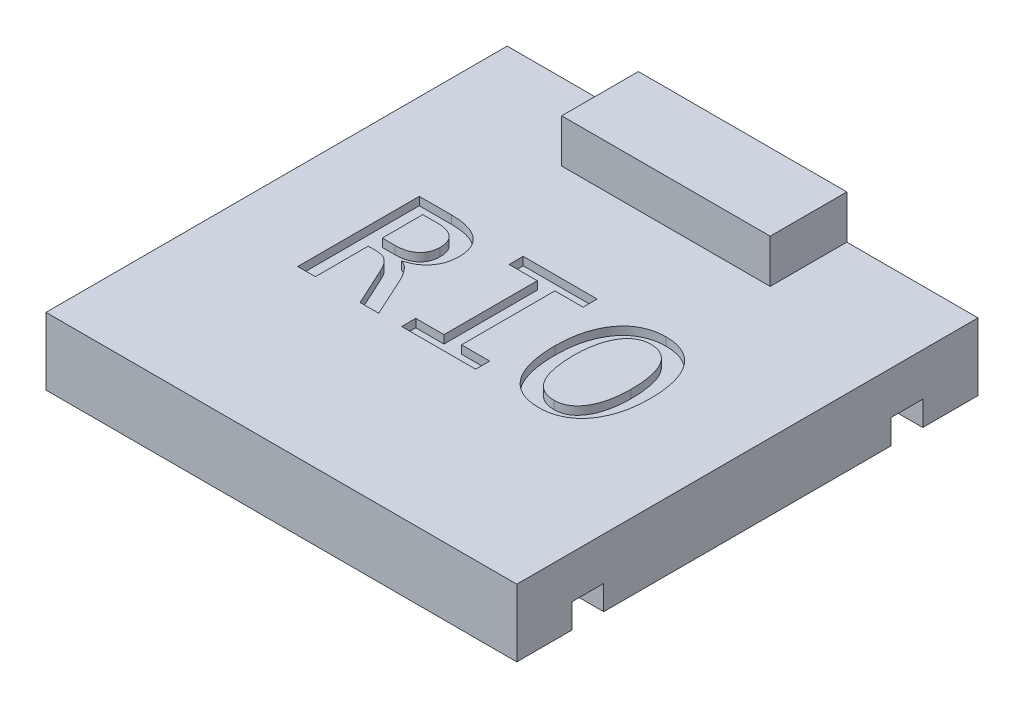
from build123d import *

# Parameters (mm, degrees)
SKETCH1_W           = 146.1516
SKETCH1_H           = 143.1798
BOSS_EXTRUDE1_DEPTH = 17.2085
SKETCH3_W           = 40.7162
SKETCH3_H           = 23.7998
CUT_EXTRUDE2_DEPTH  = 13.5128
CUT_EXTRUDE1_DEPTH  = 2.54
SKETCH4_W           = 9.8298
SKETCH4_H           = 7.62
CUT_EXTRUDE3_DEPTH  = 10.16


with BuildPart() as part:
    # Sketch1 → Boss-Extrude1 (new, symmetric)
    with BuildSketch(Plane(origin=(0, 0, 0), x_dir=(1, 0, 0), z_dir=(0, 1, 0))):
        with Locations((73.0758, 71.5899)):
            Rectangle(SKETCH1_W, SKETCH1_H)
    extrude(amount=BOSS_EXTRUDE1_DEPTH, both=True)

    # Sketch3 → Cut-Extrude2 (cut)
    with BuildSketch(Plane(origin=(0, 17.2085, 0), x_dir=(1, 0, 0), z_dir=(0, 1, 0))):
        Polygon((0, 119.38), (0, 0), (146.1516, 0), (146.1516, 119.38), (105.4354, 119.38), (40.7162, 119.38), align=None)
        with Locations((20.3581, 131.2799)):
            Rectangle(SKETCH3_W, SKETCH3_H)
        with Locations((125.7935, 131.2799)):
            Rectangle(SKETCH3_W, SKETCH3_H)
    extrude(amount=-CUT_EXTRUDE2_DEPTH, mode=Mode.SUBTRACT)

    # Sketch2 → Cut-Extrude1 (cut)
    # profile 1 of 3: a face of its own
    with BuildSketch(Plane(origin=(0, 3.6957, 0), x_dir=(1, 0, 0), z_dir=(0, 1, 0))):
        with BuildLine():
            Line((51.897428627, 51.406813945), (46.104961162, 51.406813945))
            Line((46.104961162, 51.406813945), (40.679862577, 63.18824851))
            add(Edge.make_bspline(
                [(40.679862577, 63.18824851), (40.483830981, 63.605943537), (40.120168029, 64.38081968), (39.47986165, 65.398297488), (38.816682071, 66.21807576), (38.098308017, 66.84831408), (37.314584981, 67.308101815), (36.460547923, 67.605576377), (35.523807529, 67.778497566), (34.871097282, 67.799329504), (34.528569693, 67.810261635)],
                knots=[0, 0, 0, 0, 1.339134837, 2.484261414, 3.482991323, 4.391871607, 5.244507385, 6.105289549, 7.005698766, 8, 8, 8, 8], degree=3))
            Line((34.528569693, 67.810261635), (32.213291399, 67.810261635))
            Line((32.213291399, 67.810261635), (32.213291399, 51.406813945))
            Line((32.213291399, 51.406813945), (26.745475502, 51.406813945))
            Line((26.745475502, 51.406813945), (26.745475502, 89.134743632))
            Line((26.745475502, 89.134743632), (36.775500288, 89.134743632))
            add(Edge.make_bspline(
                [(36.775500288, 89.134743632), (37.302681799, 89.127913375), (38.31909976, 89.114744483), (39.786710459, 88.975921697), (41.139560182, 88.751972397), (42.375563132, 88.424329853), (43.503095451, 88.02397482), (44.526021136, 87.545542542), (45.444479791, 86.991805966), (46.254962537, 86.359987855), (46.971456258, 85.670484395), (47.57273165, 84.8981556), (48.082603476, 84.066279794), (48.482753218, 83.162172962), (48.786159546, 82.203686429), (49.012635335, 81.195363881), (49.139075054, 80.136040526), (49.155282954, 79.412603941), (49.163520679, 79.04491461)],
                knots=[0, 0, 0, 0, 1.390037284, 2.680023546, 3.883960013, 5.002565466, 6.047913656, 7.03574216, 7.976084698, 8.870016629, 9.741095147, 10.591561451, 11.444313202, 12.308368875, 13.191986167, 14.092206828, 15.030357037, 16, 16, 16, 16], degree=3))
            add(Edge.make_bspline(
                [(49.163520679, 79.04491461), (49.156693074, 78.748461982), (49.143265746, 78.165451251), (49.044573258, 77.30344548), (48.895136067, 76.465132853), (48.671222735, 75.65439579), (48.388857463, 74.874394586), (48.047842444, 74.125746648), (47.634014419, 73.416717874), (47.165581143, 72.739922522), (46.632586803, 72.106290479), (46.043943587, 71.513686529), (45.385574727, 70.976024668), (44.682908643, 70.470843949), (43.916726351, 70.023860793), (43.094770543, 69.641940171), (42.221223932, 69.313395824), (41.612652624, 69.149433507), (41.303535327, 69.066150599)],
                knots=[0, 0, 0, 0, 1.032708305, 2.030948508, 3.019625047, 3.996933367, 4.957424013, 5.907556856, 6.85893238, 7.814077788, 8.77200233, 9.740252168, 10.719774328, 11.730219428, 12.753012585, 13.805036997, 14.885091985, 16, 16, 16, 16], degree=3))
            add(Edge.make_bspline(
                [(41.303535327, 69.066150599), (41.554783811, 68.973998212), (42.053277595, 68.791161717), (42.738667943, 68.384004824), (43.38330315, 67.910743187), (43.947051297, 67.305916333), (44.498247106, 66.624671051), (45.044616799, 65.839696199), (45.599446914, 64.953859033), (45.948837547, 64.315083406), (46.130591549, 63.982790507)],
                knots=[0, 0, 0, 0, 0.890820497, 1.767447404, 2.649001527, 3.549193506, 4.515009134, 5.571837998, 6.736863216, 8, 8, 8, 8], degree=3))
            Line((46.130591549, 63.982790507), (51.897428627, 51.406813945))
        make_face()
        with BuildLine():
            add(Edge.make_bspline(
                [(43.695704782, 78.67754573), (43.691704724, 78.925552618), (43.683954429, 79.406077281), (43.598171311, 80.101652653), (43.451381884, 80.747459472), (43.255845154, 81.345892856), (43.011542776, 81.902591014), (42.687539634, 82.398367146), (42.321829385, 82.854515238), (41.899399839, 83.259091267), (41.42366003, 83.611042159), (40.900950503, 83.916932289), (40.336117273, 84.183602998), (39.723632751, 84.398816343), (39.064286648, 84.556156025), (38.359916992, 84.678827137), (37.608289031, 84.74404489), (37.091717716, 84.75491532), (36.826761062, 84.760490915)],
                knots=[0, 0, 0, 0, 1.136086502, 2.201219443, 3.204852043, 4.166451082, 5.083443327, 5.98129036, 6.87199526, 7.758098985, 8.653381414, 9.577773354, 10.529401831, 11.511765708, 12.546811162, 13.632454437, 14.78565276, 16, 16, 16, 16], degree=3))
            Line((36.826761062, 84.760490915), (32.213291399, 84.760490915))
            Line((32.213291399, 84.760490915), (32.213291399, 72.184514352))
            Line((32.213291399, 72.184514352), (36.168914462, 72.184514352))
            add(Edge.make_bspline(
                [(36.168914462, 72.184514352), (36.450965369, 72.189555207), (37.001923444, 72.199402008), (37.805634186, 72.272432302), (38.562800046, 72.416510462), (39.280933641, 72.586895609), (39.949586964, 72.828546714), (40.565338003, 73.12090094), (41.138548706, 73.4519071), (41.648672003, 73.849336312), (42.116382709, 74.286355769), (42.525728096, 74.774241474), (42.881825913, 75.308594618), (43.169326073, 75.896703746), (43.414841644, 76.525411495), (43.569362791, 77.208083183), (43.678255403, 77.927920177), (43.689794629, 78.42364546), (43.695704782, 78.67754573)],
                knots=[0, 0, 0, 0, 1.202615583, 2.349188572, 3.435207305, 4.486530095, 5.492783739, 6.45958443, 7.390413995, 8.308405015, 9.210274755, 10.115082188, 11.017605575, 11.940721498, 12.901403136, 13.887978084, 14.918265918, 16, 16, 16, 16], degree=3))
        make_face(mode=Mode.SUBTRACT)
    # profile 2 of 3: a face of its own
    with BuildSketch(Plane(origin=(0, 3.6957, 0), x_dir=(1, 0, 0), z_dir=(0, 1, 0))):
        Polygon((67.754094728, 84.760490915), (59.005589293, 84.760490915), (59.005589293, 89.134743632), (81.970416059, 89.134743632), (81.970416059, 84.760490915), (73.221910624, 84.760490915), (73.221910624, 55.781066662), (81.970416059, 55.781066662), (81.970416059, 51.406813945), (59.005589293, 51.406813945), (59.005589293, 55.781066662), (67.754094728, 55.781066662), align=None)
    # profile 3 of 3: a face of its own
    with BuildSketch(Plane(origin=(0, 3.6957, 0), x_dir=(1, 0, 0), z_dir=(0, 1, 0))):
        with BuildLine():
            add(Edge.make_bspline(
                [(116.964437798, 70.518539196), (116.95025853, 69.697805464), (116.922878164, 68.112957116), (116.697342365, 65.823086408), (116.339701457, 63.703494472), (115.817903409, 61.757506526), (115.162917465, 59.985518067), (114.423719335, 58.364200322), (113.568522976, 56.906472106), (112.61055432, 55.606930425), (111.55190532, 54.476809263), (110.420395987, 53.483355321), (109.178551447, 52.676205036), (107.871097107, 52.004945837), (106.498270487, 51.495185782), (105.085141369, 51.124415017), (103.631897798, 50.908161329), (102.651984462, 50.876149616), (102.158617565, 50.860032355)],
                knots=[0, 0, 0, 0, 1.423082774, 2.747992794, 3.986236128, 5.147128242, 6.236197569, 7.259302453, 8.233395673, 9.161912359, 10.053001658, 10.914402565, 11.766421957, 12.614596425, 13.458547256, 14.300675266, 15.144423756, 16, 16, 16, 16], degree=3))
            add(Edge.make_bspline(
                [(102.158617565, 50.860032355), (101.576706465, 50.875915974), (100.447200161, 50.906746538), (98.810990056, 51.160044959), (97.289489083, 51.565694189), (95.881285306, 52.141398616), (94.597388719, 52.881953953), (93.418771664, 53.760101263), (92.364160933, 54.795648247), (91.421063063, 55.971668933), (90.59684061, 57.292527711), (89.891820329, 58.749940262), (89.292445103, 60.33994047), (88.809641006, 62.061516495), (88.436714907, 63.906693328), (88.178346112, 65.867885513), (88.010027209, 67.938313744), (87.993487937, 69.356283398), (87.985013546, 70.082822617)],
                knots=[0, 0, 0, 0, 1.030115455, 1.999483942, 2.924432069, 3.813267415, 4.685316872, 5.542716903, 6.40939724, 7.295524004, 8.206506083, 9.160640047, 10.158252241, 11.211975818, 12.323750963, 13.4892538, 14.713543989, 16, 16, 16, 16], degree=3))
            add(Edge.make_bspline(
                [(87.985013546, 70.082822617), (88.000346109, 70.89490602), (88.029991432, 72.465059342), (88.240870452, 74.739036365), (88.603610375, 76.845523266), (89.116278017, 78.785746154), (89.758439774, 80.558249929), (90.502910519, 82.17406507), (91.342437541, 83.636877188), (92.308288425, 84.926308413), (93.365466628, 86.059815832), (94.498175655, 87.050435292), (95.728904343, 87.867895193), (97.029276429, 88.538225372), (98.397548025, 89.044583508), (99.807006374, 89.418442715), (101.257808362, 89.633168481), (102.23768242, 89.665331687), (102.731029542, 89.681525222)],
                knots=[0, 0, 0, 0, 1.41309666, 2.732205102, 3.969807196, 5.128608405, 6.219709524, 7.24631839, 8.221244419, 9.148965463, 10.043106611, 10.914447659, 11.761129373, 12.607796584, 13.454637821, 14.294855332, 15.141493535, 16, 16, 16, 16], degree=3))
            add(Edge.make_bspline(
                [(102.731029542, 89.681525222), (103.312843273, 89.665152983), (104.444976745, 89.633294746), (106.083301756, 89.386064369), (107.603289725, 88.96552876), (109.006366789, 88.381666644), (110.296676629, 87.641794422), (111.472794416, 86.757427306), (112.537595278, 85.729558621), (113.474072791, 84.551490771), (114.308415099, 83.239409229), (115.03606185, 81.79637607), (115.628194006, 80.208298118), (116.124165432, 78.498006977), (116.502560181, 76.663401746), (116.774434597, 74.714408038), (116.938590059, 72.654404303), (116.955680298, 71.242193902), (116.964437798, 70.518539196)],
                knots=[0, 0, 0, 0, 1.031800753, 2.007749398, 2.930678117, 3.822900438, 4.696376593, 5.562252438, 6.426830471, 7.314406963, 8.225311853, 9.18096675, 10.175487812, 11.227471919, 12.337140194, 13.495232744, 14.716489688, 16, 16, 16, 16], degree=3))
        make_face()
        with BuildLine():
            add(Edge.make_bspline(
                [(111.496621902, 70.151170316), (111.488352876, 70.697998258), (111.472149395, 71.769529149), (111.395575832, 73.341507408), (111.224407992, 74.83934071), (111.01932047, 76.264004744), (110.741781426, 77.60738672), (110.380548022, 78.856655425), (109.960834425, 80.016965389), (109.445882406, 81.072355307), (108.856410479, 82.022793378), (108.197117686, 82.876471747), (107.44151885, 83.60097473), (106.61255105, 84.218993485), (105.699591609, 84.711598538), (104.694723748, 85.065039608), (103.599446099, 85.270490036), (102.840130278, 85.29476916), (102.449095285, 85.307272505)],
                knots=[0, 0, 0, 0, 1.323673599, 2.593790554, 3.807090586, 4.970987518, 6.076778004, 7.123914636, 8.116191169, 9.059475772, 9.960330598, 10.819370074, 11.662669578, 12.485668992, 13.315223066, 14.163241623, 15.054100047, 16, 16, 16, 16], degree=3))
            add(Edge.make_bspline(
                [(102.449095285, 85.307272505), (102.069474883, 85.291472211), (101.329624884, 85.260678693), (100.256199257, 85.050703617), (99.273302745, 84.667204007), (98.374773052, 84.147288456), (97.559616031, 83.503135948), (96.832424218, 82.736647987), (96.161006129, 81.884782615), (95.579124355, 80.917912171), (95.085466372, 79.855156637), (94.629488042, 78.71296036), (94.275704834, 77.473257349), (93.962667853, 76.160724423), (93.738613918, 74.780864072), (93.579751992, 73.354954988), (93.470971215, 71.887157075), (93.458941425, 70.894650616), (93.452829442, 70.390387261)],
                knots=[0, 0, 0, 0, 0.938104053, 1.828290259, 2.688226573, 3.533173995, 4.38495139, 5.245952462, 6.138444459, 7.060521377, 8.026891732, 9.031849607, 10.096184638, 11.209149641, 12.36492099, 13.547735175, 14.754076334, 16, 16, 16, 16], degree=3))
            add(Edge.make_bspline(
                [(93.452829442, 70.390387261), (93.459547229, 69.837756499), (93.472646544, 68.760156872), (93.570281987, 67.178434873), (93.717746861, 65.672217386), (93.939556412, 64.243092228), (94.225454264, 62.903662906), (94.584603079, 61.658594488), (95.009704712, 60.507736849), (95.509147221, 59.453743106), (96.095458382, 58.507204093), (96.748954183, 57.65854473), (97.504967289, 56.942347847), (98.313936485, 56.31135781), (99.22910379, 55.830424199), (100.22358966, 55.478639117), (101.309921893, 55.27016623), (102.060867399, 55.246513295), (102.449095285, 55.234285073)],
                knots=[0, 0, 0, 0, 1.340540585, 2.613980496, 3.843097936, 5.010722051, 6.120504555, 7.163418743, 8.151508278, 9.093960035, 9.987380757, 10.848401497, 11.683877306, 12.507385072, 13.329500698, 14.179475102, 15.05881515, 16, 16, 16, 16], degree=3))
            add(Edge.make_bspline(
                [(102.449095285, 55.234285073), (102.829053607, 55.248605184), (103.567347149, 55.27643046), (104.632967713, 55.5057143), (105.620134417, 55.873331548), (106.523017579, 56.394712148), (107.346462673, 57.038300463), (108.083190566, 57.801966064), (108.753885802, 58.65903056), (109.342692921, 59.625314248), (109.860122101, 60.681691419), (110.305224964, 61.828624377), (110.680513709, 63.056325865), (110.972442545, 64.369006842), (111.214861536, 65.742345399), (111.369042534, 67.172546579), (111.478699615, 68.645816925), (111.490584202, 69.644043527), (111.496621902, 70.151170316)],
                knots=[0, 0, 0, 0, 0.936906737, 1.820494917, 2.676828052, 3.526792157, 4.383009914, 5.247809723, 6.13916262, 7.06372975, 8.034989121, 9.038664354, 10.096936984, 11.200050273, 12.355522744, 13.536827286, 14.74863997, 16, 16, 16, 16], degree=3))
        make_face(mode=Mode.SUBTRACT)
    extrude(amount=-CUT_EXTRUDE1_DEPTH, mode=Mode.SUBTRACT)

    # Sketch4 → Cut-Extrude3 (cut)
    with BuildSketch(Plane(origin=(146.1516, 0, 0), x_dir=(0, 0, -1), z_dir=(1, 0, 0))):
        with Locations((22.0599, -13.3985)):
            Rectangle(SKETCH4_W, SKETCH4_H)
        with Locations((121.1199, -13.3985)):
            Rectangle(SKETCH4_W, SKETCH4_H)
    cut_extrude3 = extrude(amount=-CUT_EXTRUDE3_DEPTH, mode=Mode.SUBTRACT)

    # Mirror1: Cut-Extrude3 across plane
    add(cut_extrude3.mirror(Plane.ZY.offset(-73.0758)), mode=Mode.SUBTRACT)


solid = part.part
